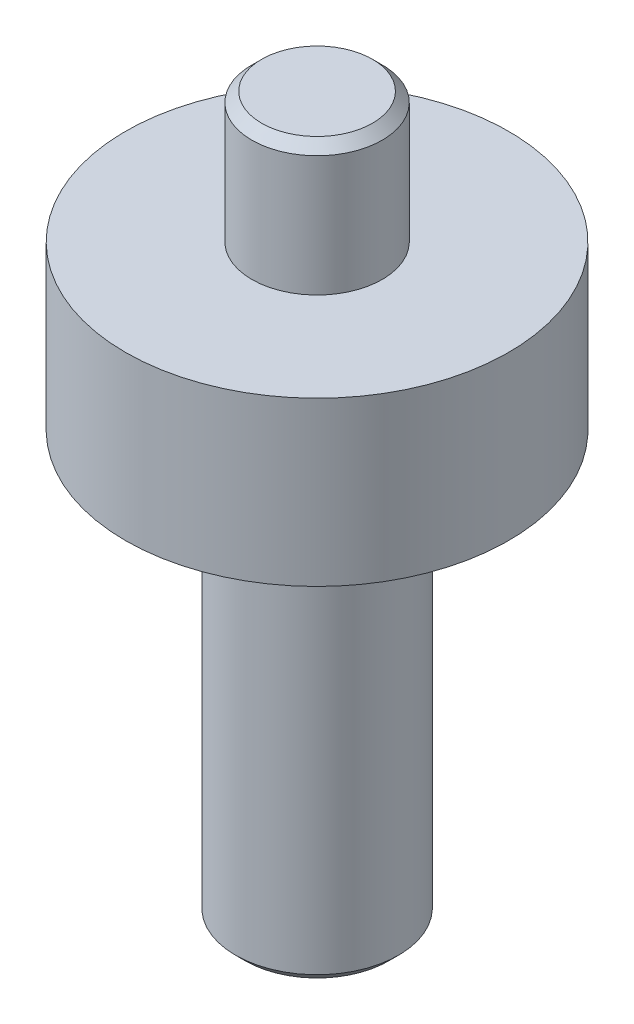
from build123d import *

# Parameters (mm, degrees)
SKETCH_1_R          = 11.75
EXTRUDE_1_DEPTH     = 10
SKETCH_1_3_R        = 6
EXTRUDE_2_DEPTH     = 4
SKETCH_1_4_R        = 5
EXTRUDE_3_DEPTH     = 26
CHAMFER_1_SIZE      = 0.6
SKETCH_2_R          = 4
EXTRUDE_4_DEPTH     = 8
CHAMFER_2_SIZE      = 0.6
CUT_EXTRUDE_1_DEPTH = 10


with BuildPart() as part:
    # 草图1 → 凸台-拉伸1 (new body)
    with BuildSketch(Plane(origin=(0, 0, 0), x_dir=(1, 0, 0), z_dir=(0, 1, 0))):
        Circle(SKETCH_1_R)
    extrude(amount=EXTRUDE_1_DEPTH)

    # 草图1<3> → 凸台-拉伸2 (add)
    with BuildSketch(Plane(origin=(0, 0, 0), x_dir=(1, 0, 0), z_dir=(0, 1, 0))):
        Circle(SKETCH_1_3_R)
    extrude(amount=-EXTRUDE_2_DEPTH)

    # 草图1<4> → 凸台-拉伸3 (add)
    with BuildSketch(Plane(origin=(0, 0, 0), x_dir=(1, 0, 0), z_dir=(0, 1, 0))):
        Circle(SKETCH_1_4_R)
    extrude(amount=-EXTRUDE_3_DEPTH)

    # 倒角1
    chamfer_1_edges = [part.edges().sort_by_distance(p)[0] for p in [
        (-5, -26, 0),
    ]]
    chamfer(chamfer_1_edges, length=CHAMFER_1_SIZE)

    # 草图2 → 凸台-拉伸4 (add)
    with BuildSketch(Plane(origin=(0, 10, 0), x_dir=(1, 0, 0), z_dir=(0, 1, 0))):
        Circle(SKETCH_2_R)
    extrude(amount=EXTRUDE_4_DEPTH)

    # 倒角2
    chamfer_2_edges = [part.edges().sort_by_distance(p)[0] for p in [
        (-4, 18, 0),
    ]]
    chamfer(chamfer_2_edges, length=CHAMFER_2_SIZE)

    # 草图3 → 切除-拉伸1 (cut)
    with BuildSketch(Plane(origin=(-3.5, 0, 0), x_dir=(0, 0, -1), z_dir=(1, 0, 0))):
        with BuildLine():
            Line((-2, -22.2), (-2, -7.2))
            ThreePointArc((-2, -7.2), (0, -5.2), (2, -7.2))
            Line((2, -7.2), (2, -22.2))
            ThreePointArc((2, -22.2), (0, -24.2), (-2, -22.2))
        make_face()
    extrude(amount=-CUT_EXTRUDE_1_DEPTH, mode=Mode.SUBTRACT)


solid = part.part
